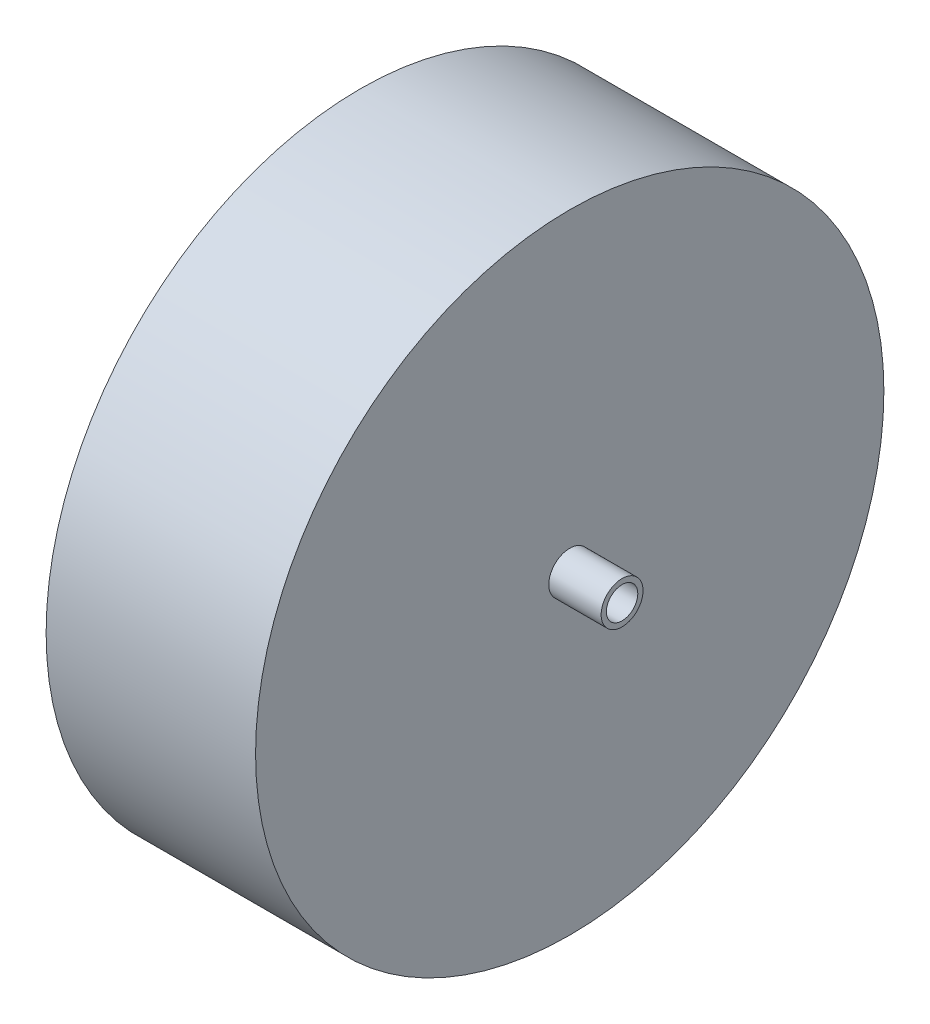
from build123d import *

# Parameters (mm, degrees)
SKETCH_1_R      = 4
SKETCH_1_R_2    = 3
EXTRUDE_1_DEPTH = 10
SKETCH_2_R      = 60
EXTRUDE_2_DEPTH = 40


with BuildPart() as part:
    # 草图1 → 凸台-拉伸1 (new body)
    with BuildSketch(Plane(origin=(0, 0, 0), x_dir=(0, 0, -1), z_dir=(1, 0, 0))):
        Circle(SKETCH_1_R)
        Circle(SKETCH_1_R_2, mode=Mode.SUBTRACT)
    extrude(amount=EXTRUDE_1_DEPTH)

    # 草图2 → 凸台-拉伸2 (add)
    with BuildSketch(Plane.ZY):
        Circle(SKETCH_2_R)
    extrude(amount=EXTRUDE_2_DEPTH)


solid = part.part
